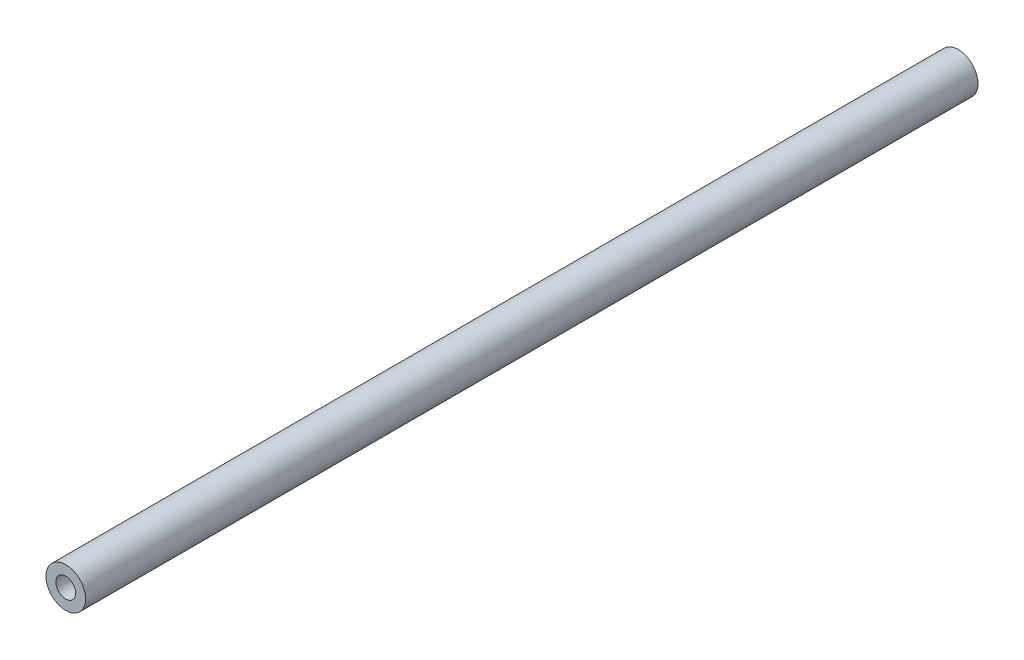
from build123d import *

# Parameters (mm, degrees)
SKETCH_2_R      = 10
SKETCH_2_R_2    = 5
EXTRUDE_1_DEPTH = 450


with BuildPart() as part:
    # 스케치2 → 보스-돌출1 (new body)
    with BuildSketch(Plane.XY):
        Circle(SKETCH_2_R)
        Circle(SKETCH_2_R_2, mode=Mode.SUBTRACT)
    extrude(amount=EXTRUDE_1_DEPTH)


solid = part.part
